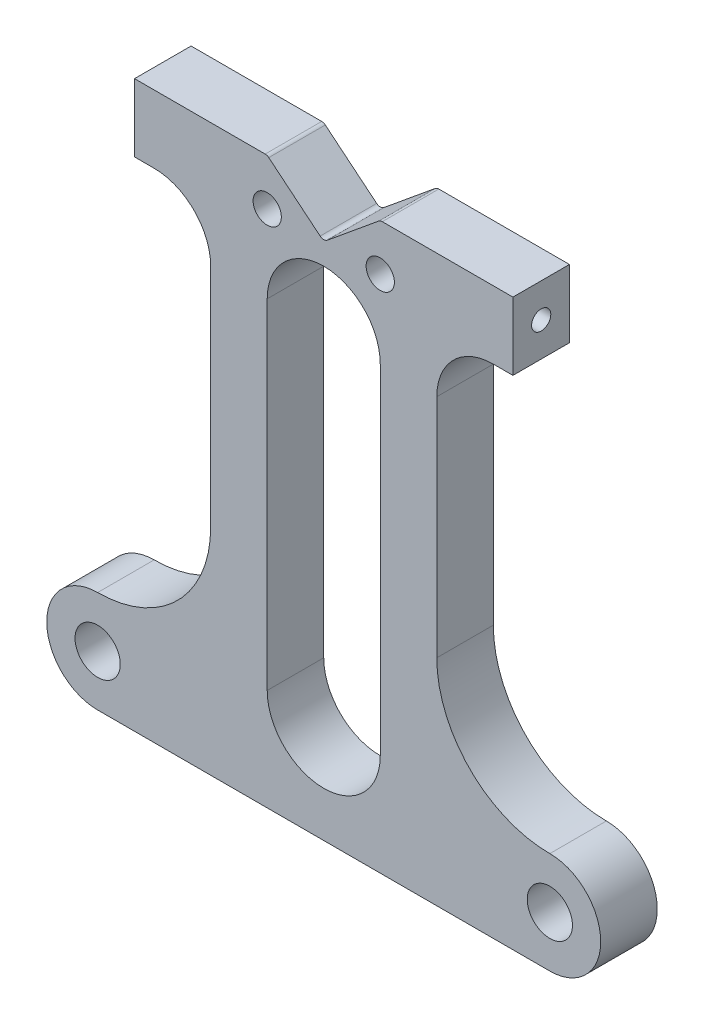
from build123d import *

# Parameters (mm, degrees)
SKETCH1_R                = 2.5
SKETCH1_R_2              = 4
BOSS_EXTRUDE1_DEPTH      = 5
FILLET1_R                = 1
M3_CLEARANCE_HOLE1_D     = 3.4
M3_CLEARANCE_HOLE1_DEPTH = 5
M3_CLEARANCE_HOLE1_TIP   = 1.021463052


with BuildPart() as part:
    # Sketch1 → Boss-Extrude1 (new, symmetric)
    with BuildSketch(Plane.XY):
        with BuildLine():
            ThreePointArc((10, 9), (7.071067812, 1.928932188), (0, -1))
            Line((0, -1), (0, -9))
            Line((0, -9), (40, -9))
            ThreePointArc((40, -9), (49, 0), (40, 9))
            ThreePointArc((40, 9), (25.857864376, 14.857864376), (20, 29))
            Line((20, 29), (20, 69))
            ThreePointArc((20, 69), (22.928932188, 76.071067812), (30, 79))
            Line((30, 79), (33.47, 79))
            Line((33.47, 79), (33.47, 91))
            Line((33.47, 91), (10, 91))
            Line((10, 91), (0, 82.776266062))
            Line((0, 82.776266062), (0, 79))
            ThreePointArc((0, 79), (7.071067812, 76.071067812), (10, 69))
            Line((10, 69), (10, 9))
        make_face()
        with Locations((10, 82.776266062)):
            Circle(SKETCH1_R, mode=Mode.SUBTRACT)
        with Locations((40, 0)):
            Circle(SKETCH1_R_2, mode=Mode.SUBTRACT)
    boss_extrude1 = extrude(amount=BOSS_EXTRUDE1_DEPTH, both=True)

    # Mirror1: Boss-Extrude1 across plane
    add(boss_extrude1.mirror(Plane(origin=(0, 0, 5), x_dir=(0, 0, 1), z_dir=(-1, 0, 0))))

    # Fillet1
    fillet1_edges = [part.edges().sort_by_distance(p)[0] for p in [
        (0, 82.776266062, 0),
        (10, 91, 0),
        (-10, 91, 0),
    ]]
    fillet(fillet1_edges, radius=FILLET1_R)

    # M3 Clearance Hole1
    with Locations(Plane(origin=(33.47, 0, 0), x_dir=(0, 0, -1), z_dir=(1, 0, 0))):
        with Locations((0, 85)):
            Hole(M3_CLEARANCE_HOLE1_D / 2, depth=M3_CLEARANCE_HOLE1_DEPTH)
            with Locations((0, 0, -(M3_CLEARANCE_HOLE1_DEPTH + M3_CLEARANCE_HOLE1_TIP / 2))):  # 118° drill point
                Cone(0, M3_CLEARANCE_HOLE1_D / 2, M3_CLEARANCE_HOLE1_TIP, mode=Mode.SUBTRACT)


solid = part.part
